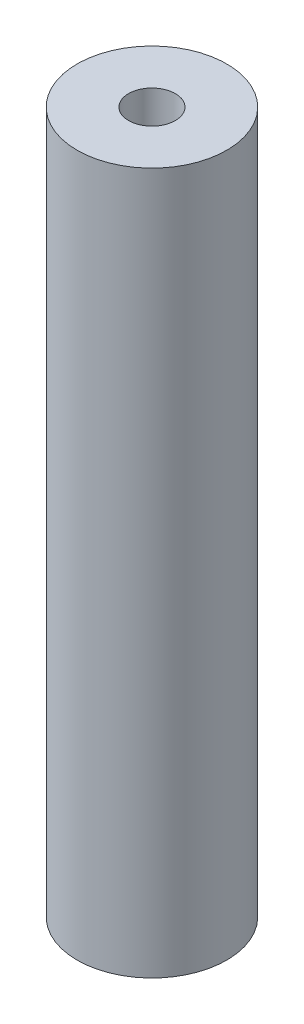
from build123d import *

# Parameters (mm, degrees)
SKETCH_1_R      = 8
EXTRUDE_1_DEPTH = 37.5


with BuildPart() as part:
    # 草图1 → 凸台-拉伸1 (new, symmetric)
    with BuildSketch(Plane(origin=(0, 0, 0), x_dir=(1, 0, 0), z_dir=(0, 1, 0))):
        with Locations(Location((0, 0, 0), (0, 0, 270))):
            Circle(SKETCH_1_R)
    extrude(amount=EXTRUDE_1_DEPTH, both=True)

    # 草图3 → M6 螺纹孔1 (revolve, cut)
    with BuildSketch(Plane(origin=(0, 37.5, 0), x_dir=(0, 0, 1), z_dir=(1, 0, 0))):
        Polygon((0, 0), (0, 18.502151548), (2.5, 17), (2.5, 0), align=None)
    hole_wizard_m6_1 = revolve(axis=Axis((0, 43.85, 0), (0, -1, 0)), mode=Mode.SUBTRACT)

    # 镜向1: M6 螺纹孔1 across plane
    add(hole_wizard_m6_1.mirror(Plane.ZX), mode=Mode.SUBTRACT)


solid = part.part
